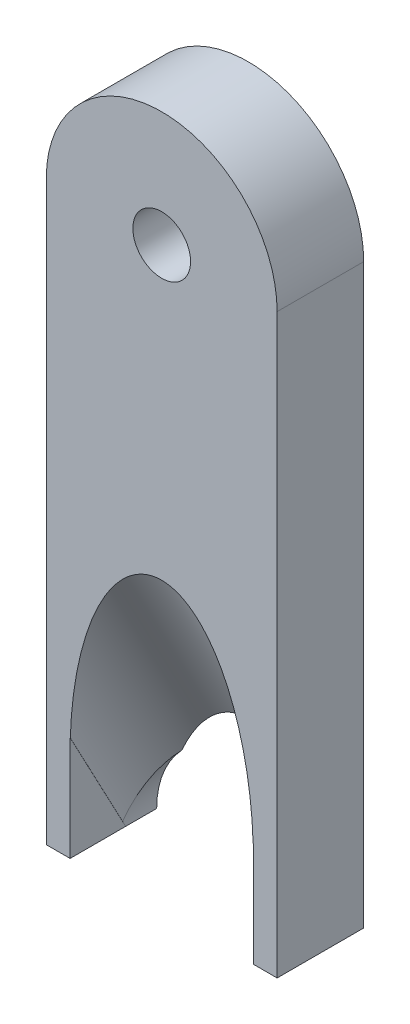
from build123d import *

# Parameters (mm, degrees)
SKETCH1_R           = 5
BOSS_EXTRUDE1_DEPTH = 15
SKETCH2_R           = 15.875
CUT_EXTRUDE1_DEPTH  = 64
SKETCH4_W           = 31.75
SKETCH4_H           = 8.5
CUT_EXTRUDE2_DEPTH  = 61


with BuildPart() as part:
    # Sketch1 → Boss-Extrude1 (new body)
    with BuildSketch(Plane.XY):
        with BuildLine():
            Line((-20, 0), (-20, -100))
            Line((-20, -100), (-15.875, -100))
            ThreePointArc((-15.875, -100), (0, -84.125), (15.875, -100))
            Line((15.875, -100), (20, -100))
            Line((20, -100), (20, 0))
            ThreePointArc((20, 0), (0, 20), (-20, 0))
        make_face()
        Circle(SKETCH1_R, mode=Mode.SUBTRACT)
    extrude(amount=BOSS_EXTRUDE1_DEPTH)

    # Sketch2 → Cut-Extrude1 (cut)
    with BuildSketch(Plane(origin=(0, -77.959645174, -41.451878628), x_dir=(1, 0, 0), z_dir=(0, 0.8829475928589248, 0.46947156278589486))):
        with Locations((0, -52.738509112)):
            Circle(SKETCH2_R)
    extrude(amount=CUT_EXTRUDE1_DEPTH, mode=Mode.SUBTRACT)

    # Sketch4 → Cut-Extrude2 (cut)
    with BuildSketch(Plane(origin=(0, -77.959645174, -41.451878628), x_dir=(1, 0, 0), z_dir=(0, 0.8829475928589248, 0.46947156278589486))):
        with Locations((0, -55.941370171)):
            Rectangle(SKETCH4_W, SKETCH4_H)
    extrude(amount=CUT_EXTRUDE2_DEPTH, mode=Mode.SUBTRACT)


solid = part.part
